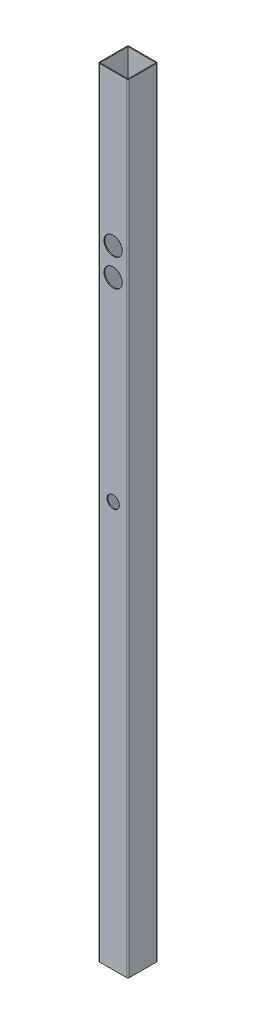
from build123d import *

# Parameters (mm, degrees)
SKETCH1_W           = 65
SKETCH1_H           = 65
SKETCH1_W_2         = 61
SKETCH1_H_2         = 61
BOSS_EXTRUDE1_DEPTH = 1700
CUT_EXTRUDE1_REACH  = 1703.553
SKETCH2_R           = 3
SKETCH2_R_2         = 27.5
FILLET1_R           = 3
CUT_EXTRUDE2_REACH  = 1703.553
SKETCH3_R           = 20
SKETCH4_R           = 13.5
CUT_EXTRUDE3_DEPTH  = 1702.552599833


with BuildPart() as part:
    # Sketch1 → Boss-Extrude1 (new body)
    with BuildSketch(Plane(origin=(0, 0, 0), x_dir=(1, 0, 0), z_dir=(0, 1, 0))):
        Rectangle(SKETCH1_W, SKETCH1_H)
        Rectangle(SKETCH1_W_2, SKETCH1_H_2, mode=Mode.SUBTRACT)
    extrude(amount=BOSS_EXTRUDE1_DEPTH)

    # Sketch2 → Cut-Extrude1 (cut, up to next)
    with BuildSketch(Plane(origin=(0, 0, -32.5), x_dir=(-1, 0, 0), z_dir=(0, 0, -1)), mode=Mode.PRIVATE) as cut_extrude1_sk1:
        with Locations((20, 1400)):
            Circle(SKETCH2_R)
    cut_extrude1_tool1 = extrude(cut_extrude1_sk1.sketch, amount=-CUT_EXTRUDE1_REACH, mode=Mode.PRIVATE) & part.part
    # Sketch2 → Cut-Extrude1 (cut, up to next)
    with BuildSketch(Plane(origin=(0, 0, -32.5), x_dir=(-1, 0, 0), z_dir=(0, 0, -1)), mode=Mode.PRIVATE) as cut_extrude1_sk2:
        with Locations((-20, 1400)):
            Circle(SKETCH2_R)
    cut_extrude1_tool2 = extrude(cut_extrude1_sk2.sketch, amount=-CUT_EXTRUDE1_REACH, mode=Mode.PRIVATE) & part.part
    # Sketch2 → Cut-Extrude1 (cut, up to next)
    with BuildSketch(Plane(origin=(0, 0, -32.5), x_dir=(-1, 0, 0), z_dir=(0, 0, -1)), mode=Mode.PRIVATE) as cut_extrude1_sk3:
        with Locations((20, 1340)):
            Circle(SKETCH2_R)
    cut_extrude1_tool3 = extrude(cut_extrude1_sk3.sketch, amount=-CUT_EXTRUDE1_REACH, mode=Mode.PRIVATE) & part.part
    # Sketch2 → Cut-Extrude1 (cut, up to next)
    with BuildSketch(Plane(origin=(0, 0, -32.5), x_dir=(-1, 0, 0), z_dir=(0, 0, -1)), mode=Mode.PRIVATE) as cut_extrude1_sk4:
        with Locations((-20, 1340)):
            Circle(SKETCH2_R)
    cut_extrude1_tool4 = extrude(cut_extrude1_sk4.sketch, amount=-CUT_EXTRUDE1_REACH, mode=Mode.PRIVATE) & part.part
    # Sketch2 → Cut-Extrude1 (cut, up to next)
    with BuildSketch(Plane(origin=(0, 0, -32.5), x_dir=(-1, 0, 0), z_dir=(0, 0, -1)), mode=Mode.PRIVATE) as cut_extrude1_sk5:
        with Locations(Location((-20, 1280, 0), (0, 0, 180))):
            Circle(SKETCH2_R)
    cut_extrude1_tool5 = extrude(cut_extrude1_sk5.sketch, amount=-CUT_EXTRUDE1_REACH, mode=Mode.PRIVATE) & part.part
    # Sketch2 → Cut-Extrude1 (cut, up to next)
    with BuildSketch(Plane(origin=(0, 0, -32.5), x_dir=(-1, 0, 0), z_dir=(0, 0, -1)), mode=Mode.PRIVATE) as cut_extrude1_sk6:
        with Locations(Location((20, 1280, 0), (0, 0, 180))):
            Circle(SKETCH2_R)
    cut_extrude1_tool6 = extrude(cut_extrude1_sk6.sketch, amount=-CUT_EXTRUDE1_REACH, mode=Mode.PRIVATE) & part.part
    # Sketch2 → Cut-Extrude1 (cut, up to next)
    with BuildSketch(Plane(origin=(0, 0, -32.5), x_dir=(-1, 0, 0), z_dir=(0, 0, -1)), mode=Mode.PRIVATE) as cut_extrude1_sk7:
        with Locations((0, 300)):
            Circle(SKETCH2_R_2)
    cut_extrude1_tool7 = extrude(cut_extrude1_sk7.sketch, amount=-CUT_EXTRUDE1_REACH, mode=Mode.PRIVATE) & part.part
    add(cut_extrude1_tool1.solids().sort_by_distance((-20, 1400, -32.5))[0], mode=Mode.SUBTRACT)
    add(cut_extrude1_tool2.solids().sort_by_distance((20, 1400, -32.5))[0], mode=Mode.SUBTRACT)
    add(cut_extrude1_tool3.solids().sort_by_distance((-20, 1340, -32.5))[0], mode=Mode.SUBTRACT)
    add(cut_extrude1_tool4.solids().sort_by_distance((20, 1340, -32.5))[0], mode=Mode.SUBTRACT)
    add(cut_extrude1_tool5.solids().sort_by_distance((20, 1280, -32.5))[0], mode=Mode.SUBTRACT)
    add(cut_extrude1_tool6.solids().sort_by_distance((-20, 1280, -32.5))[0], mode=Mode.SUBTRACT)
    add(cut_extrude1_tool7.solids().sort_by_distance((0, 300, -32.5))[0], mode=Mode.SUBTRACT)

    # Fillet1
    fillet1_edges = [part.edges().sort_by_distance(p)[0] for p in [
        (32.5, 850, 32.5),
        (-32.5, 850, 32.5),
        (-32.5, 850, -32.5),
        (32.5, 850, -32.5),
    ]]
    fillet(fillet1_edges, radius=FILLET1_R)

    # Sketch3 → Cut-Extrude2 (cut, up to next)
    with BuildSketch(Plane.XY.offset(32.5), mode=Mode.PRIVATE) as cut_extrude2_sk1:
        with Locations((0, 1370)):
            Circle(SKETCH3_R)
    cut_extrude2_tool1 = extrude(cut_extrude2_sk1.sketch, amount=-CUT_EXTRUDE2_REACH, mode=Mode.PRIVATE) & part.part
    # Sketch3 → Cut-Extrude2 (cut, up to next)
    with BuildSketch(Plane.XY.offset(32.5), mode=Mode.PRIVATE) as cut_extrude2_sk2:
        with Locations((0, 1310)):
            Circle(SKETCH3_R)
    cut_extrude2_tool2 = extrude(cut_extrude2_sk2.sketch, amount=-CUT_EXTRUDE2_REACH, mode=Mode.PRIVATE) & part.part
    add(cut_extrude2_tool1.solids().sort_by_distance((0, 1370, 32.5))[0], mode=Mode.SUBTRACT)
    add(cut_extrude2_tool2.solids().sort_by_distance((0, 1310, 32.5))[0], mode=Mode.SUBTRACT)

    # Sketch4 → Cut-Extrude3 (cut, through all)
    with BuildSketch(Plane(origin=(0, 0, -32.5), x_dir=(-1, 0, 0), z_dir=(0, 0, -1))):
        with Locations((0, 885.5)):
            Circle(SKETCH4_R)
    extrude(amount=-CUT_EXTRUDE3_DEPTH, mode=Mode.SUBTRACT)


solid = part.part
